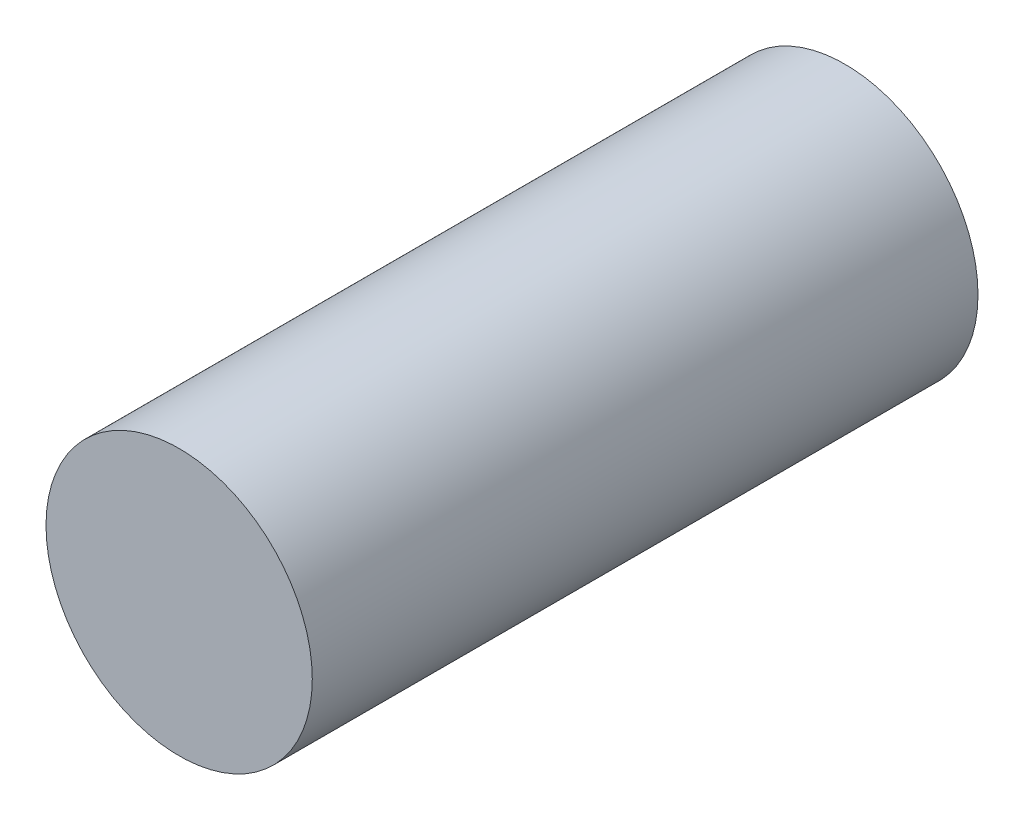
from build123d import *

# Parameters (mm, degrees)
TOPPING_KAT1_KAPAK_PIMI_D8_2_START = -40
SKETCH1_R                          = 4
TOPPING_KAT1_KAPAK_PIMI_D8_2_DEPTH = 20


with BuildPart() as part:
    # Sketch1 → TOPPING_kat1_kapak_pimi_D8_2 (new body)
    with BuildSketch(Plane.XY.offset(TOPPING_KAT1_KAPAK_PIMI_D8_2_START)):
        with Locations((460, 1744)):
            Circle(SKETCH1_R)
    extrude(amount=-TOPPING_KAT1_KAPAK_PIMI_D8_2_DEPTH)


solid = part.part
